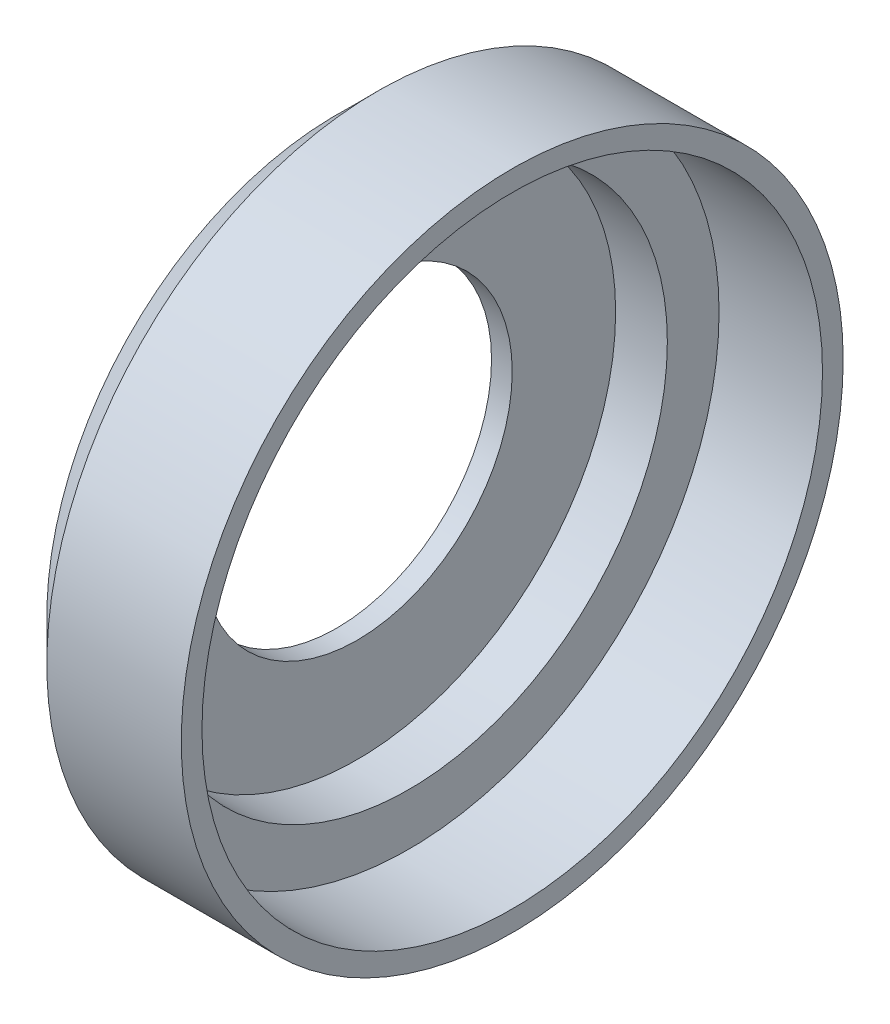
from build123d import *


with BuildPart() as part:
    # Sketch1 → Revolve1 (revolve)
    with BuildSketch(Plane(origin=(0, 0, 0), x_dir=(1, 0, 0), z_dir=(0, 1, 0))):
        Polygon((-11.339546479, 9.525), (-10.069546479, 9.525), (-10.069546479, 15.875), (-6.894546479, 15.875), (-6.894546479, 19.05), (-0.544546479, 19.05), (-0.544546479, 20.32), (-8.799546479, 20.32), (-11.339546479, 17.78), align=None)
    revolve(axis=Axis((0, 0, 0), (-1, 0, 0)))


solid = part.part
